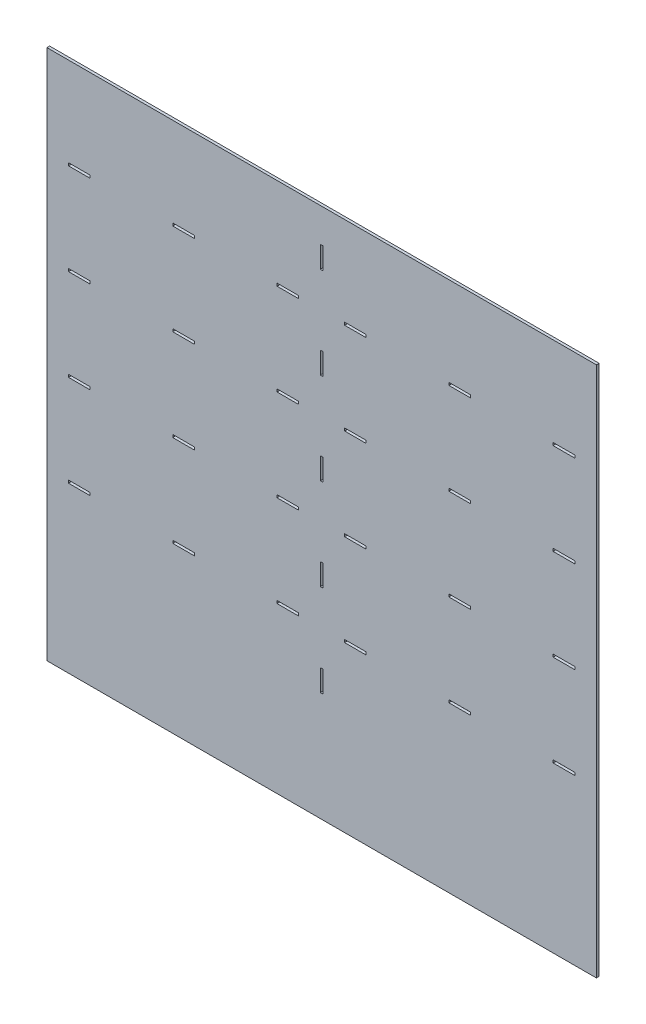
from build123d import *

# Parameters (mm, degrees)
SKETCH8_W           = 645.65784
SKETCH8_H           = 534.99766
SKETCH8_W_2         = 3.175
SKETCH8_H_2         = 25.4
SKETCH8_W_3         = 25.4
SKETCH8_H_3         = 3.175
SKETCH8_H_4         = 3.21056
BOSS_EXTRUDE2_DEPTH = 3.175
SKETCH10_W          = 645.65784
SKETCH10_H          = 88.9
BOSS_EXTRUDE6_DEPTH = 3.175


with BuildPart() as part:
    # Sketch8 → Boss-Extrude2 (new body)
    with BuildSketch(Plane.XY):
        with Locations((317.62192, 262.29183)):
            Rectangle(SKETCH8_W, SKETCH8_H)
        with Locations((317.62192, 477.56445)):
            Rectangle(SKETCH8_W_2, SKETCH8_H_2, mode=Mode.SUBTRACT)
        with Locations((317.62192, 369.93703)):
            Rectangle(SKETCH8_W_2, SKETCH8_H_2, mode=Mode.SUBTRACT)
        with Locations((317.62192, 262.458260384)):
            Rectangle(SKETCH8_W_2, SKETCH8_H_2, mode=Mode.SUBTRACT)
        with Locations((317.62192, 154.681954488)):
            Rectangle(SKETCH8_W_2, SKETCH8_H_2, mode=Mode.SUBTRACT)
        with Locations((317.62192, 46.891109833)):
            Rectangle(SKETCH8_W_2, SKETCH8_H_2, mode=Mode.SUBTRACT)
        with Locations((32.893, 423.75074)):
            Rectangle(SKETCH8_W_3, SKETCH8_H_3, mode=Mode.SUBTRACT)
        with Locations((155.41371, 423.75074)):
            Rectangle(SKETCH8_W_3, SKETCH8_H_3, mode=Mode.SUBTRACT)
        with Locations((32.893, 316.12332)):
            Rectangle(SKETCH8_W_3, SKETCH8_H_3, mode=Mode.SUBTRACT)
        with Locations((32.893, 208.4959)):
            Rectangle(SKETCH8_W_3, SKETCH8_H_3, mode=Mode.SUBTRACT)
        with Locations((32.893, 100.8507)):
            Rectangle(SKETCH8_W_3, SKETCH8_H_4, mode=Mode.SUBTRACT)
        with Locations((277.93442, 423.75074)):
            Rectangle(SKETCH8_W_3, SKETCH8_H_3, mode=Mode.SUBTRACT)
        with Locations((155.41371, 316.12332)):
            Rectangle(SKETCH8_W_3, SKETCH8_H_3, mode=Mode.SUBTRACT)
        with Locations((155.41371, 208.4959)):
            Rectangle(SKETCH8_W_3, SKETCH8_H_3, mode=Mode.SUBTRACT)
        with Locations((155.41371, 100.8507)):
            Rectangle(SKETCH8_W_3, SKETCH8_H_4, mode=Mode.SUBTRACT)
        with Locations((277.93442, 316.12332)):
            Rectangle(SKETCH8_W_3, SKETCH8_H_3, mode=Mode.SUBTRACT)
        with Locations((277.93442, 208.4959)):
            Rectangle(SKETCH8_W_3, SKETCH8_H_3, mode=Mode.SUBTRACT)
        with Locations((277.93442, 100.8507)):
            Rectangle(SKETCH8_W_3, SKETCH8_H_4, mode=Mode.SUBTRACT)
        with Locations((602.35084, 100.8507)):
            Rectangle(SKETCH8_W_3, SKETCH8_H_4, mode=Mode.SUBTRACT)
        with Locations((479.83013, 100.8507)):
            Rectangle(SKETCH8_W_3, SKETCH8_H_4, mode=Mode.SUBTRACT)
        with Locations((357.30942, 100.8507)):
            Rectangle(SKETCH8_W_3, SKETCH8_H_4, mode=Mode.SUBTRACT)
        with Locations((357.30942, 208.4959)):
            Rectangle(SKETCH8_W_3, SKETCH8_H_3, mode=Mode.SUBTRACT)
        with Locations((479.83013, 208.4959)):
            Rectangle(SKETCH8_W_3, SKETCH8_H_3, mode=Mode.SUBTRACT)
        with Locations((602.35084, 208.4959)):
            Rectangle(SKETCH8_W_3, SKETCH8_H_3, mode=Mode.SUBTRACT)
        with Locations((602.35084, 316.12332)):
            Rectangle(SKETCH8_W_3, SKETCH8_H_3, mode=Mode.SUBTRACT)
        with Locations((479.83013, 316.12332)):
            Rectangle(SKETCH8_W_3, SKETCH8_H_3, mode=Mode.SUBTRACT)
        with Locations((357.30942, 316.12332)):
            Rectangle(SKETCH8_W_3, SKETCH8_H_3, mode=Mode.SUBTRACT)
        with Locations((357.30942, 423.75074)):
            Rectangle(SKETCH8_W_3, SKETCH8_H_3, mode=Mode.SUBTRACT)
        with Locations((479.83013, 423.75074)):
            Rectangle(SKETCH8_W_3, SKETCH8_H_3, mode=Mode.SUBTRACT)
        with Locations((602.35084, 423.75074)):
            Rectangle(SKETCH8_W_3, SKETCH8_H_3, mode=Mode.SUBTRACT)
    extrude(amount=BOSS_EXTRUDE2_DEPTH)

    # Sketch10 → Boss-Extrude6 (add, through all)
    with BuildSketch(Plane.XY.offset(3.175)):
        with Locations((317.62192, -49.657)):
            Rectangle(SKETCH10_W, SKETCH10_H)
    extrude(amount=-BOSS_EXTRUDE6_DEPTH)


solid = part.part
